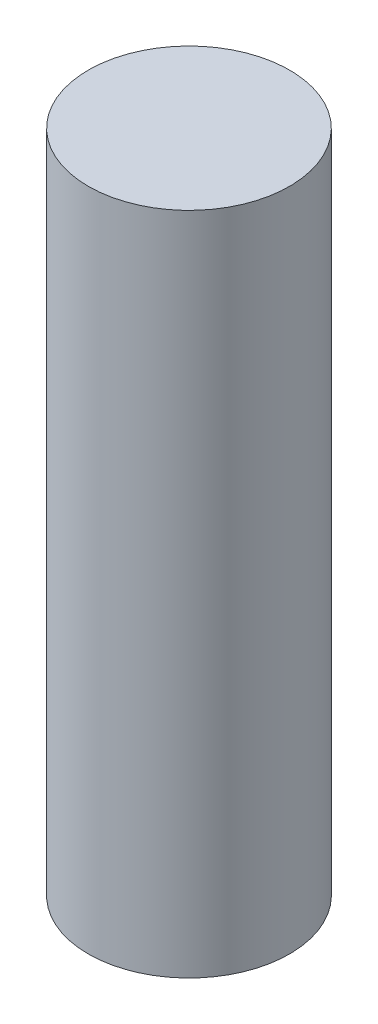
from build123d import *

# Parameters (mm, degrees)
SKETCH1_R = 7.5


with BuildPart() as part:
    # Sweep2: sweep along a path in Sketch3
    with BuildLine(Plane.XY) as sweep2_path:
        Line((0, 0), (0, 49.526136737))
    # Sketch1 → Sweep2 (sweep)
    with BuildSketch(Plane(origin=(0, 0, 0), x_dir=(1, 0, 0), z_dir=(0, 1, 0))):
        Circle(SKETCH1_R)
    sweep(path=sweep2_path.line)


solid = part.part
